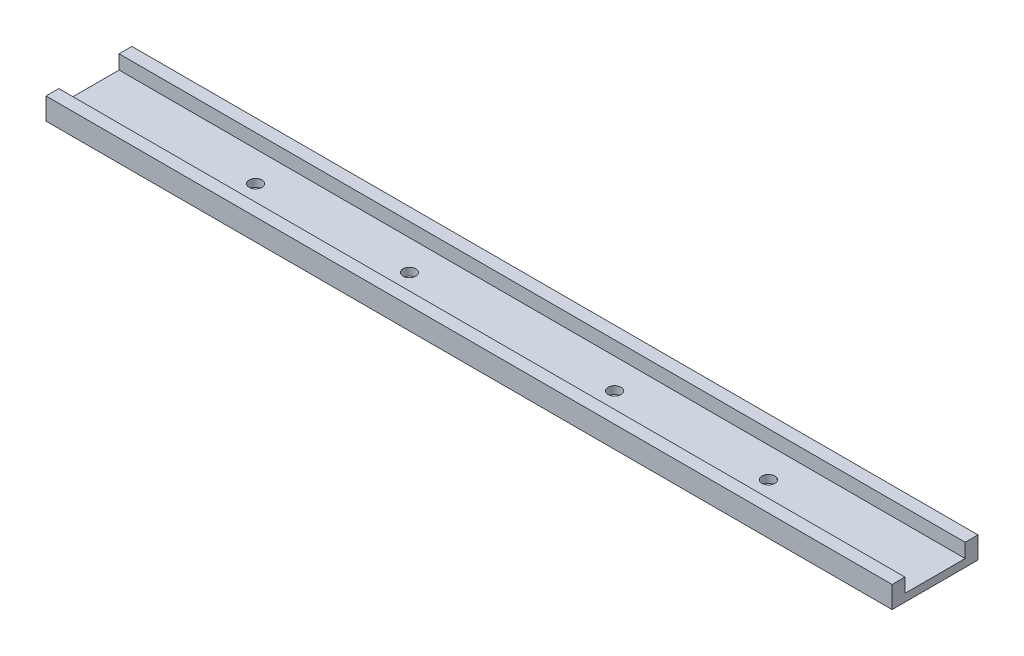
from build123d import *

# Parameters (mm, degrees)
SKETCH_1_W            = 330
SKETCH_1_H            = 33.5
EXTRUDE_1_DEPTH       = 8.5
SKETCH_2_W            = 23.5
SKETCH_2_H            = 5.5
CUT_EXTRUDE_1_DEPTH   = 332.804912562
HOLE_WIZARD_5_0_5_1_D = 5


with BuildPart() as part:
    # Эскиз1 → Бобышка-Вытянуть1 (new body)
    with BuildSketch(Plane(origin=(0, 8.5, 0), x_dir=(1, 0, 0), z_dir=(0, 1, 0))):
        with Locations((165, -16.75)):
            Rectangle(SKETCH_1_W, SKETCH_1_H)
    extrude(amount=-EXTRUDE_1_DEPTH)

    # Эскиз2 → Вырез-Вытянуть1 (cut, through all)
    with BuildSketch(Plane(origin=(330, 0, 0), x_dir=(0, 0, -1), z_dir=(1, 0, 0))):
        with Locations((-16.75, 5.75)):
            Rectangle(SKETCH_2_W, SKETCH_2_H)
    extrude(amount=-CUT_EXTRUDE_1_DEPTH, mode=Mode.SUBTRACT)

    # Диаметр отверстия Ø5.0 (5)1 (through all)
    with Locations(Plane(origin=(0, 3, 0), x_dir=(1, 0, 0), z_dir=(0, 1, 0))):
        with Locations((65, -16.75), (125, -16.75), (265, -16.75), (205, -16.75)):
            Hole(HOLE_WIZARD_5_0_5_1_D / 2)


solid = part.part
